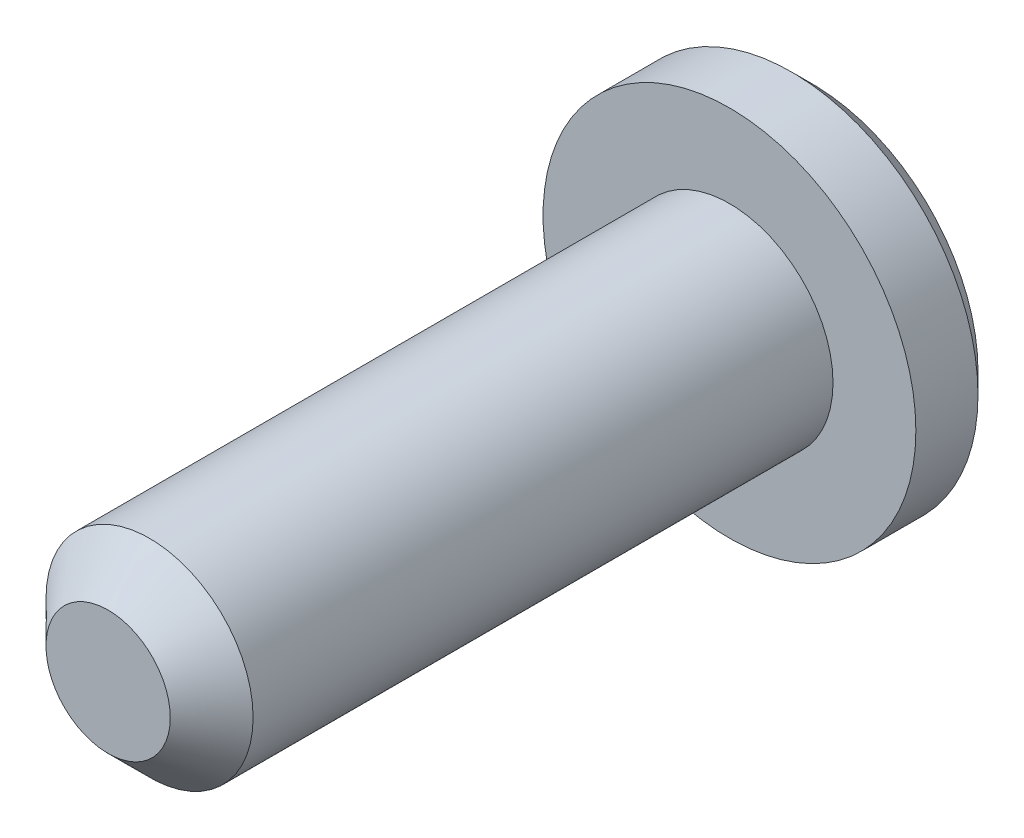
from build123d import *

# Parameters (mm, degrees)
SKETCH2_R           = 5
BOSS_EXTRUDE1_DEPTH = 30
SKETCH1_R           = 9
BASE_EXTRUDE_DEPTH  = 4
CHAMFER1_SIZE       = 1
CHAMFER2_SIZE       = 2


with BuildPart() as part:
    # Sketch2 (on Front Plane) → Boss-Extrude1 (new body)
    with BuildSketch(Plane.XY):
        Circle(SKETCH2_R)
    extrude(amount=BOSS_EXTRUDE1_DEPTH)

    # Sketch1 → Base-Extrude (add)
    with BuildSketch(Plane.XY):
        Circle(SKETCH1_R)
    extrude(amount=-BASE_EXTRUDE_DEPTH)

    # Chamfer1
    chamfer1_edges = [part.edges().sort_by_distance(p)[0] for p in [
        (-9, 0, -4),
    ]]
    chamfer(chamfer1_edges, length=CHAMFER1_SIZE)

    # Chamfer2
    chamfer2_edges = [part.edges().sort_by_distance(p)[0] for p in [
        (-5, 0, 30),
    ]]
    chamfer(chamfer2_edges, length=CHAMFER2_SIZE)


solid = part.part
